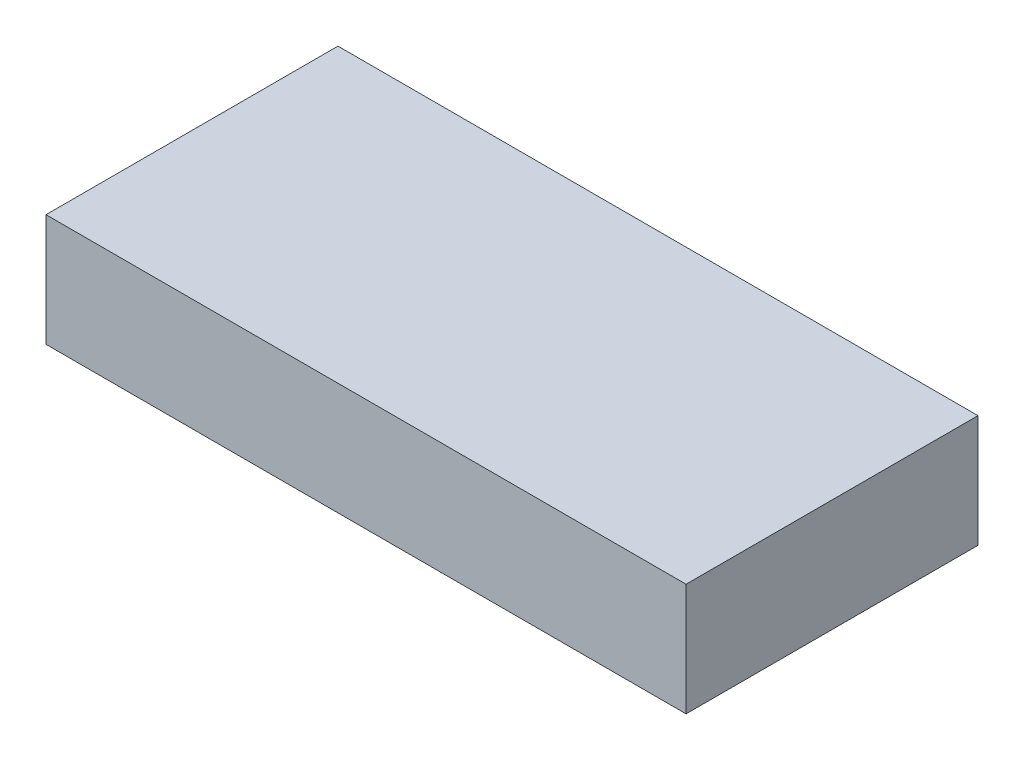
from build123d import *

# Parameters (mm, degrees)
SKETCH1_W           = 28.5
SKETCH1_H           = 13
BOSS_EXTRUDE1_DEPTH = 5


with BuildPart() as part:
    # Sketch1 → Boss-Extrude1 (new body)
    with BuildSketch(Plane(origin=(0, 0, 0), x_dir=(1, 0, 0), z_dir=(0, 1, 0))):
        with Locations((14.25, 6.5)):
            Rectangle(SKETCH1_W, SKETCH1_H)
    extrude(amount=BOSS_EXTRUDE1_DEPTH)


solid = part.part
